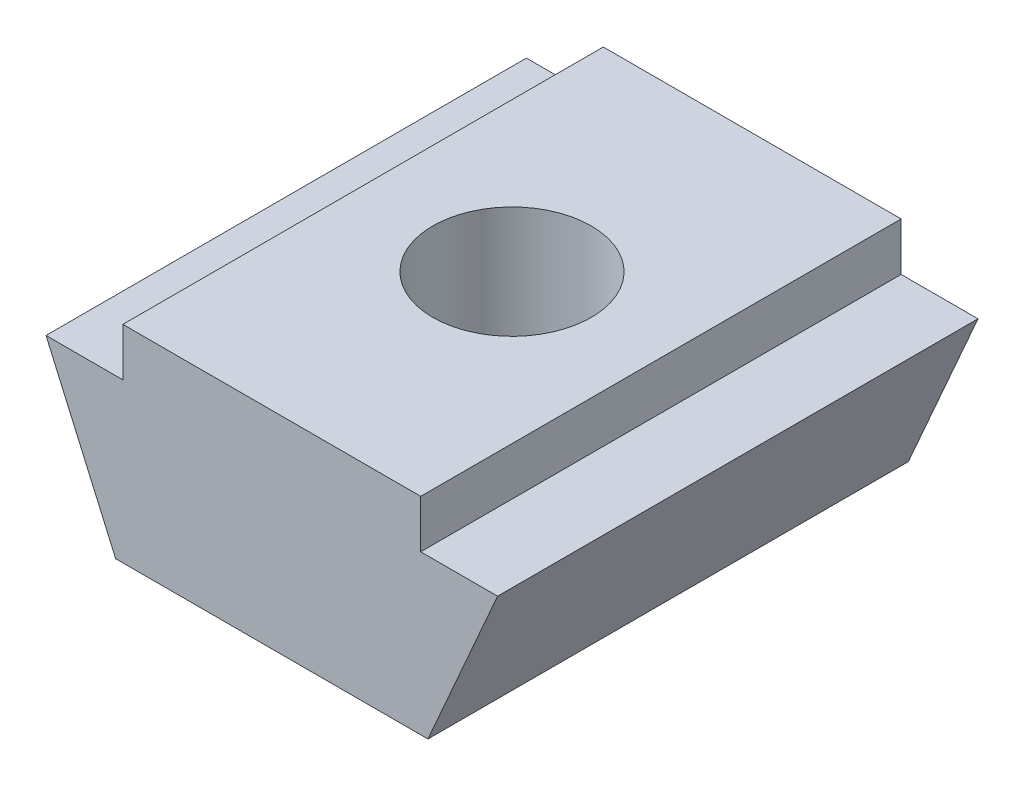
from build123d import *

# Parameters (mm, degrees)
BOSS_EXTRUDE1_DEPTH       = 5
M4X0_7_TAPPED_HOLE2_D     = 3.3
M4X0_7_TAPPED_HOLE2_DEPTH = 11.5
M4X0_7_TAPPED_HOLE2_TIP   = 0.991420021


with BuildPart() as part:
    # Sketch1 → Boss-Extrude1 (new, symmetric)
    with BuildSketch(Plane.XY):
        Polygon((-3.25, 0), (3.25, 0), (4.7, 3.3), (3.1, 3.3), (3.1, 4.3), (-3.1, 4.3), (-3.1, 3.3), (-4.7, 3.3), align=None)
    extrude(amount=BOSS_EXTRUDE1_DEPTH, both=True)

    # M4x0.7 Tapped Hole2
    with Locations(Plane(origin=(0, 4.3, 0), x_dir=(1, 0, 0), z_dir=(0, 1, 0))):
        with Locations((0, 0)):
            Hole(M4X0_7_TAPPED_HOLE2_D / 2, depth=M4X0_7_TAPPED_HOLE2_DEPTH)
            with Locations((0, 0, -(M4X0_7_TAPPED_HOLE2_DEPTH + M4X0_7_TAPPED_HOLE2_TIP / 2))):  # 118° drill point
                Cone(0, M4X0_7_TAPPED_HOLE2_D / 2, M4X0_7_TAPPED_HOLE2_TIP, mode=Mode.SUBTRACT)


solid = part.part
